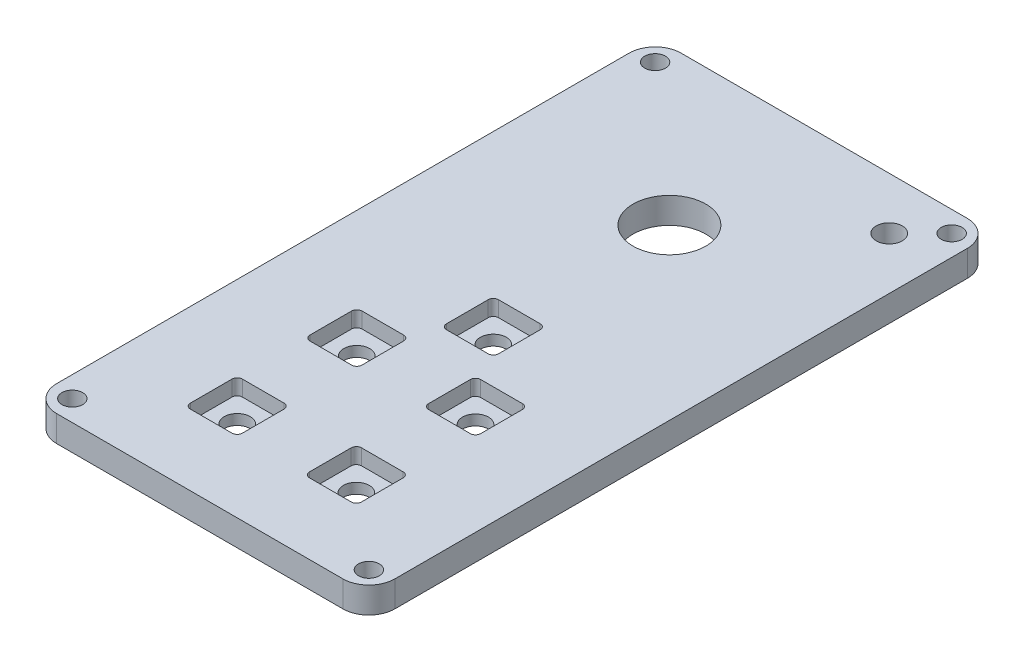
from build123d import *

# Parameters (mm, degrees)
BOSS_EXTRUDE1_DEPTH = 5
SKETCH2_R           = 1.05
CUT_EXTRUDE1_DEPTH  = 5
SKETCH3_R           = 2
CUT_EXTRUDE2_DEPTH  = 3
CUT_EXTRUDE3_DEPTH  = 69.419660917
SKETCH5_R           = 2.5
CUT_EXTRUDE5_DEPTH  = 69.419660917
CUT_EXTRUDE7_DEPTH  = 3


with BuildPart() as part:
    # Sketch1 → Boss-Extrude1 (new body)
    with BuildSketch(Plane(origin=(0, 0, 0), x_dir=(1, 0, 0), z_dir=(0, 1, 0))):
        with BuildLine():
            Line((-27.5, 60), (27.5, 60))
            ThreePointArc((27.5, 60), (31.035533906, 58.535533906), (32.5, 55))
            Line((32.5, 55), (32.5, -55))
            ThreePointArc((32.5, -55), (31.035533906, -58.535533906), (27.5, -60))
            Line((27.5, -60), (-27.5, -60))
            ThreePointArc((-27.5, -60), (-31.035533906, -58.535533906), (-32.5, -55))
            Line((-32.5, -55), (-32.5, 55))
            ThreePointArc((-32.5, 55), (-31.035533906, 58.535533906), (-27.5, 60))
        make_face()
    extrude(amount=BOSS_EXTRUDE1_DEPTH)

    # Sketch2 → Cut-Extrude1 (cut)
    with BuildSketch(Plane(origin=(0, 5, 0), x_dir=(1, 0, 0), z_dir=(0, 1, 0))):
        with Locations(Location((-28.5, 56, 0), (0, 0, 270))):
            Circle(SKETCH2_R)
        with Locations(Location((28.5, 56, 0), (0, 0, 270))):
            Circle(SKETCH2_R)
        with Locations(Location((28.5, -56, 0), (0, 0, 270))):
            Circle(SKETCH2_R)
        with Locations(Location((-28.5, -56, 0), (0, 0, 270))):
            Circle(SKETCH2_R)
    extrude(amount=-CUT_EXTRUDE1_DEPTH, mode=Mode.SUBTRACT)

    # Sketch3 → Cut-Extrude2 (cut)
    with BuildSketch(Plane(origin=(0, 5, 0), x_dir=(1, 0, 0), z_dir=(0, 1, 0))):
        with Locations(Location((-28.5, 56, 0), (0, 0, 270))):
            Circle(SKETCH3_R)
        with Locations(Location((28.5, 56, 0), (0, 0, 270))):
            Circle(SKETCH3_R)
        with Locations(Location((28.5, -56, 0), (0, 0, 270))):
            Circle(SKETCH3_R)
        with Locations(Location((-28.5, -56, 0), (0, 0, 270))):
            Circle(SKETCH3_R)
    extrude(amount=-CUT_EXTRUDE2_DEPTH, mode=Mode.SUBTRACT)

    # Sketch4 → Cut-Extrude3 (cut, through all)
    with BuildSketch(Plane(origin=(0, 5, 0), x_dir=(1, 0, 0), z_dir=(0, 1, 0))):
        with BuildLine():
            ThreePointArc((7, 30.254330519), (4.949747468, 35.204077987), (0, 37.254330519))
            Line((0, 37.254330519), (0, 23.254330519))
            ThreePointArc((0, 23.254330519), (4.949747468, 25.304583051), (7, 30.254330519))
        make_face()
        with BuildLine():
            Line((0, 23.254330519), (0, 37.254330519))
            ThreePointArc((0, 37.254330519), (-7, 30.254330519), (0, 23.254330519))
        make_face()
    extrude(amount=-CUT_EXTRUDE3_DEPTH, mode=Mode.SUBTRACT)

    # Sketch5 → Cut-Extrude5 (cut, through all)
    with BuildSketch(Plane(origin=(0, 5, 0), x_dir=(1, 0, 0), z_dir=(0, 1, 0))):
        with Locations(Location((22.5, 50, 0), (0, 0, 270))):
            Circle(SKETCH5_R)
        with Locations(Location((0, -3.584481164, 0), (0, 0, 270))):
            Circle(SKETCH5_R)
        with Locations(Location((11.568109832, -18.584481164, 0), (0, 0, 270))):
            Circle(SKETCH5_R)
        with Locations(Location((11.487471201, -41.402489438, 0), (0, 0, 270))):
            Circle(SKETCH5_R)
        with Locations(Location((-11.406832571, -41.406832571, 0), (0, 0, 270))):
            Circle(SKETCH5_R)
        with Locations(Location((-11.24555531, -18.584481164, 0), (0, 0, 270))):
            Circle(SKETCH5_R)
    extrude(amount=-CUT_EXTRUDE5_DEPTH, mode=Mode.SUBTRACT)

    # Sketch6 → Cut-Extrude7 (cut)
    with BuildSketch(Plane(origin=(0, 5, 0), x_dir=(1, 0, 0), z_dir=(0, 1, 0))):
        with BuildLine():
            Line((7.568109832, -13.584481164), (15.568109832, -13.584481164))
            ThreePointArc((15.568109832, -13.584481164), (16.275216613, -13.877374383), (16.568109832, -14.584481164))
            Line((16.568109832, -14.584481164), (16.568109832, -22.584481164))
            ThreePointArc((16.568109832, -22.584481164), (16.275216613, -23.291587945), (15.568109832, -23.584481164))
            Line((15.568109832, -23.584481164), (7.568109832, -23.584481164))
            ThreePointArc((7.568109832, -23.584481164), (6.86100305, -23.291587945), (6.568109832, -22.584481164))
            Line((6.568109832, -22.584481164), (6.568109832, -14.584481164))
            ThreePointArc((6.568109832, -14.584481164), (6.86100305, -13.877374383), (7.568109832, -13.584481164))
        make_face()
        with BuildLine():
            Line((-15.24555531, -13.584481164), (-7.24555531, -13.584481164))
            ThreePointArc((-7.24555531, -13.584481164), (-6.538448529, -13.877374383), (-6.24555531, -14.584481164))
            Line((-6.24555531, -14.584481164), (-6.24555531, -22.584481164))
            ThreePointArc((-6.24555531, -22.584481164), (-6.538448529, -23.291587945), (-7.24555531, -23.584481164))
            Line((-7.24555531, -23.584481164), (-15.24555531, -23.584481164))
            ThreePointArc((-15.24555531, -23.584481164), (-15.952662092, -23.291587945), (-16.24555531, -22.584481164))
            Line((-16.24555531, -22.584481164), (-16.24555531, -14.584481164))
            ThreePointArc((-16.24555531, -14.584481164), (-15.952662092, -13.877374383), (-15.24555531, -13.584481164))
        make_face()
        with BuildLine():
            Line((-15.406832571, -36.406832571), (-7.406832571, -36.406832571))
            ThreePointArc((-7.406832571, -36.406832571), (-6.69972579, -36.69972579), (-6.406832571, -37.406832571))
            Line((-6.406832571, -37.406832571), (-6.406832571, -45.406832571))
            ThreePointArc((-6.406832571, -45.406832571), (-6.69972579, -46.113939352), (-7.406832571, -46.406832571))
            Line((-7.406832571, -46.406832571), (-15.406832571, -46.406832571))
            ThreePointArc((-15.406832571, -46.406832571), (-16.113939352, -46.113939352), (-16.406832571, -45.406832571))
            Line((-16.406832571, -45.406832571), (-16.406832571, -37.406832571))
            ThreePointArc((-16.406832571, -37.406832571), (-16.113939352, -36.69972579), (-15.406832571, -36.406832571))
        make_face()
        with BuildLine():
            Line((7.487471201, -36.402489438), (15.487471201, -36.402489438))
            ThreePointArc((15.487471201, -36.402489438), (16.194577983, -36.695382657), (16.487471201, -37.402489438))
            Line((16.487471201, -37.402489438), (16.487471201, -45.402489438))
            ThreePointArc((16.487471201, -45.402489438), (16.194577983, -46.10959622), (15.487471201, -46.402489438))
            Line((15.487471201, -46.402489438), (7.487471201, -46.402489438))
            ThreePointArc((7.487471201, -46.402489438), (6.78036442, -46.10959622), (6.487471201, -45.402489438))
            Line((6.487471201, -45.402489438), (6.487471201, -37.402489438))
            ThreePointArc((6.487471201, -37.402489438), (6.78036442, -36.695382657), (7.487471201, -36.402489438))
        make_face()
        with BuildLine():
            Line((-4, 1.415518836), (4, 1.415518836))
            ThreePointArc((4, 1.415518836), (4.707106781, 1.122625617), (5, 0.415518836))
            Line((5, 0.415518836), (5, -7.584481164))
            ThreePointArc((5, -7.584481164), (4.707106781, -8.291587945), (4, -8.584481164))
            Line((4, -8.584481164), (-4, -8.584481164))
            ThreePointArc((-4, -8.584481164), (-4.707106781, -8.291587945), (-5, -7.584481164))
            Line((-5, -7.584481164), (-5, 0.415518836))
            ThreePointArc((-5, 0.415518836), (-4.707106781, 1.122625617), (-4, 1.415518836))
        make_face()
    extrude(amount=-CUT_EXTRUDE7_DEPTH, mode=Mode.SUBTRACT)


solid = part.part
